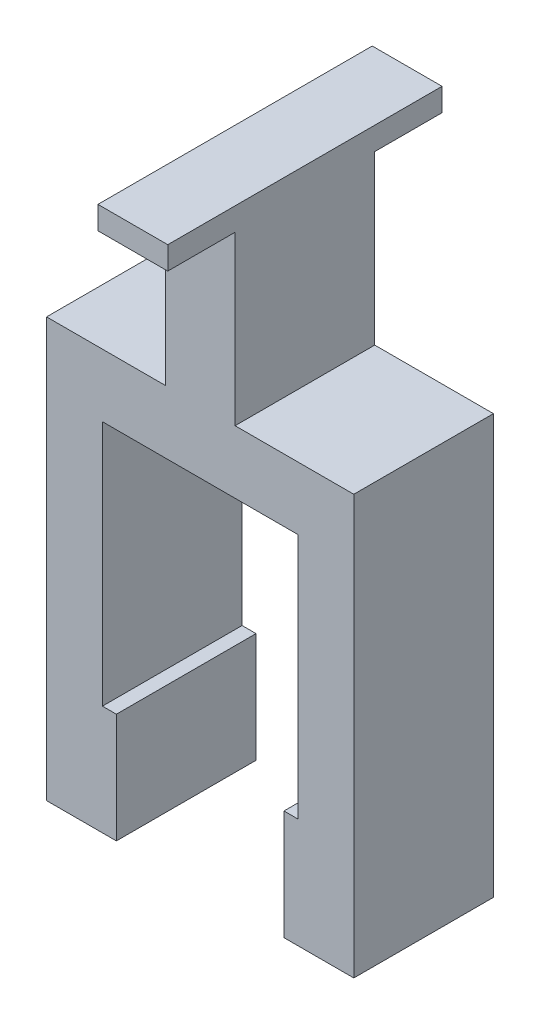
from build123d import *

# Parameters (mm, degrees)
EXTRUDE_1_DEPTH = 10
EXTRUDE_2_DEPTH = 2.5
EXTRUDE_3_DEPTH = 2.5


with BuildPart() as part:
    # 草图1 → 凸台-拉伸1 (new body)
    with BuildSketch(Plane.XY):
        Polygon((-6, -2.715432056), (-6, -10.574613101), (-11, -10.574613101), (-11, 19.425386899), (-5, 19.425386899), (5, 19.425386899), (11, 19.425386899), (11, -10.574613101), (6, -10.574613101), (6, -2.715432056), (7, -2.715432056), (7, 14.925386899), (-7, 14.925386899), (-7, -2.715432056), align=None)
    extrude(amount=EXTRUDE_1_DEPTH)

    # 草图2 → 凸台-拉伸2 (add)
    with BuildSketch(Plane(origin=(0, 0, 0), x_dir=(0, 0, -1), z_dir=(1, 0, 0))):
        Polygon((-10, 19.425386899), (-10, 31.425386899), (-14.821209098, 31.425386899), (-14.821209098, 33.063700588), (4.821209098, 33.063700588), (4.821209098, 31.425386899), (0, 31.425386899), (0, 19.425386899), align=None)
    extrude(amount=EXTRUDE_2_DEPTH)

    # 草图2<2> → 凸台-拉伸3 (add)
    with BuildSketch(Plane(origin=(0, 0, 0), x_dir=(0, 0, -1), z_dir=(1, 0, 0))):
        Polygon((-10, 19.425386899), (-10, 31.425386899), (-14.821209098, 31.425386899), (-14.821209098, 33.063700588), (4.821209098, 33.063700588), (4.821209098, 31.425386899), (0, 31.425386899), (0, 19.425386899), align=None)
    extrude(amount=-EXTRUDE_3_DEPTH)


solid = part.part
